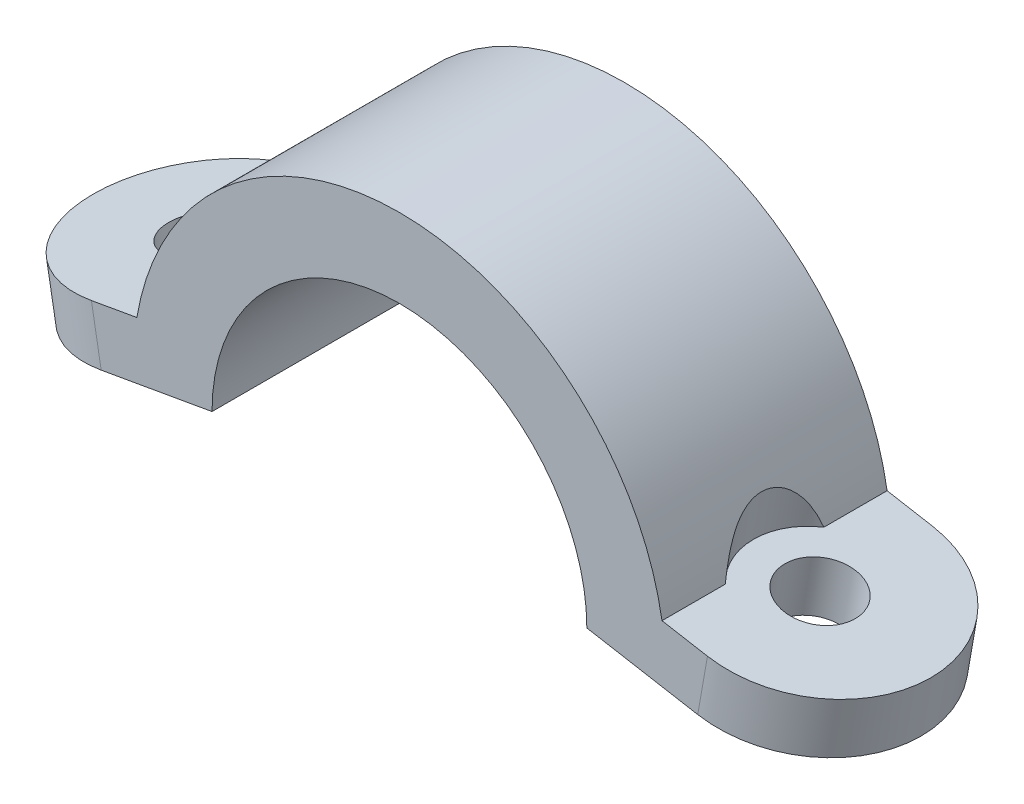
from build123d import *

# Parameters (mm, degrees)
BOSS_EXTRUDE1_DEPTH = 20
BOSS_EXTRUDE2_DEPTH = 5
BOSS_EXTRUDE4_DEPTH = 5
SKETCH8_R           = 3.175
CUT_EXTRUDE2_DEPTH  = 47.2699694
SKETCH9_R           = 6
CUT_EXTRUDE3_DEPTH  = 5
SKETCH10_R          = 3.175
CUT_EXTRUDE4_DEPTH  = 47.269969478
SKETCH11_R          = 6
CUT_EXTRUDE5_DEPTH  = 5


with BuildPart() as part:
    # Sketch1 → Boss-Extrude1 (new body)
    with BuildSketch(Plane.XY):
        with BuildLine():
            Line((16.65, 0), (23.618063018, -1.228657513))
            ThreePointArc((23.618063018, -1.228657513), (0, 23.65), (-23.618063018, -1.228657513))
            Line((-23.618063018, -1.228657513), (-16.65, 0))
            ThreePointArc((-16.65, 0), (0, 16.65), (16.65, 0))
        make_face()
    extrude(amount=BOSS_EXTRUDE1_DEPTH)

    # Sketch2 → Boss-Extrude2 (add)
    with BuildSketch(Plane(origin=(0.502058932, 2.847317693, 0), x_dir=(-0.9848077530122079, 0.1736481776669312, 0), z_dir=(-0.1736481776669312, -0.9848077530122079, 0))):
        with BuildLine():
            Line((-26.397049088, 0), (-16.397049088, 0))
            Line((-16.397049088, 0), (-16.397049088, -20))
            Line((-16.397049088, -20), (-26.397049088, -20))
            ThreePointArc((-26.397049088, -20), (-36.397049088, -10), (-26.397049088, 0))
        make_face()
    extrude(amount=-BOSS_EXTRUDE2_DEPTH)

    # Sketch6 → Boss-Extrude4 (add)
    with BuildSketch(Plane(origin=(-0.502058932, 2.847317693, 0), x_dir=(0.9848077530122087, 0.173648177666927, 0), z_dir=(0.173648177666927, -0.9848077530122087, 0))):
        with BuildLine():
            Line((-26.397049088, 20), (-16.397049088, 20))
            Line((-16.397049088, 20), (-16.397049088, 0))
            Line((-16.397049088, 0), (-26.397049088, 0))
            ThreePointArc((-26.397049088, 0), (-36.397049088, 10), (-26.397049088, 20))
        make_face()
    extrude(amount=-BOSS_EXTRUDE4_DEPTH)

    # Sketch8 → Cut-Extrude2 (cut, through all)
    with BuildSketch(Plane(origin=(-1.37029982, 7.771356458, 0), x_dir=(0.9848077530122087, 0.173648177666927, 0), z_dir=(-0.173648177666927, 0.9848077530122087, 0))):
        with Locations(Location((-26.397049088, -10, 0), (0, 0, 180))):
            Circle(SKETCH8_R)
    extrude(amount=-CUT_EXTRUDE2_DEPTH, mode=Mode.SUBTRACT)

    # Sketch9 → Cut-Extrude3 (cut)
    with BuildSketch(Plane(origin=(-1.37029982, 7.771356458, 0), x_dir=(0.9848077530122087, 0.173648177666927, 0), z_dir=(-0.173648177666927, 0.9848077530122087, 0))):
        with Locations((-26.397049088, -10)):
            Circle(SKETCH9_R)
    extrude(amount=CUT_EXTRUDE3_DEPTH, mode=Mode.SUBTRACT)

    # Sketch10 → Cut-Extrude4 (cut, through all)
    with BuildSketch(Plane(origin=(1.37029982, 7.771356458, 0), x_dir=(0.9848077530122079, -0.1736481776669312, 0), z_dir=(0.1736481776669312, 0.9848077530122079, 0))):
        with Locations(Location((26.397049088, -10, 0), (0, 0, 180))):
            Circle(SKETCH10_R)
    extrude(amount=-CUT_EXTRUDE4_DEPTH, mode=Mode.SUBTRACT)

    # Sketch11 → Cut-Extrude5 (cut)
    with BuildSketch(Plane(origin=(1.37029982, 7.771356458, 0), x_dir=(0.9848077530122079, -0.1736481776669312, 0), z_dir=(0.1736481776669312, 0.9848077530122079, 0))):
        with Locations((26.397049088, -10)):
            Circle(SKETCH11_R)
    extrude(amount=CUT_EXTRUDE5_DEPTH, mode=Mode.SUBTRACT)


solid = part.part
